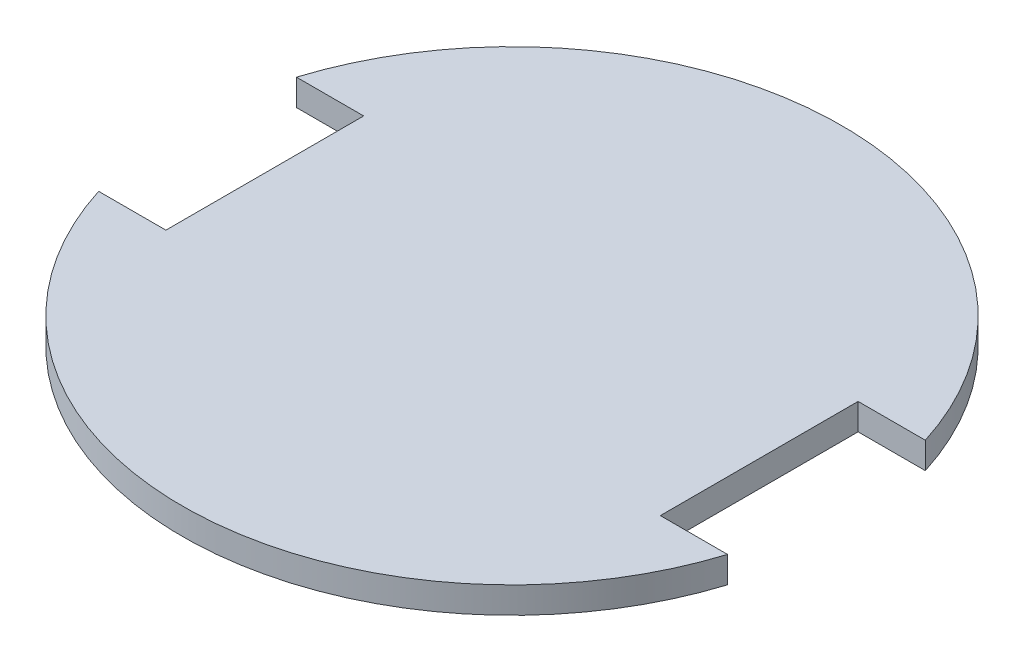
from build123d import *

# Parameters (mm, degrees)
BOSS_EXTRU_1_DEPTH = 8


with BuildPart() as part:
    # Esquisse1 → Boss.-Extru.1 (new body)
    with BuildSketch(Plane(origin=(0, 0, 0), x_dir=(1, 0, 0), z_dir=(0, 1, 0))):
        with BuildLine():
            Line((-75, 30), (-75, -30))
            Line((-75, -30), (-95.393920142, -30))
            ThreePointArc((-95.393920142, -30), (0, -100), (95.393920142, -30))
            Line((95.393920142, -30), (75, -30))
            Line((75, -30), (75, 30))
            Line((75, 30), (95.393920142, 30))
            ThreePointArc((95.393920142, 30), (0, 100), (-95.393920142, 30))
            Line((-95.393920142, 30), (-75, 30))
        make_face()
    extrude(amount=BOSS_EXTRU_1_DEPTH)


solid = part.part
